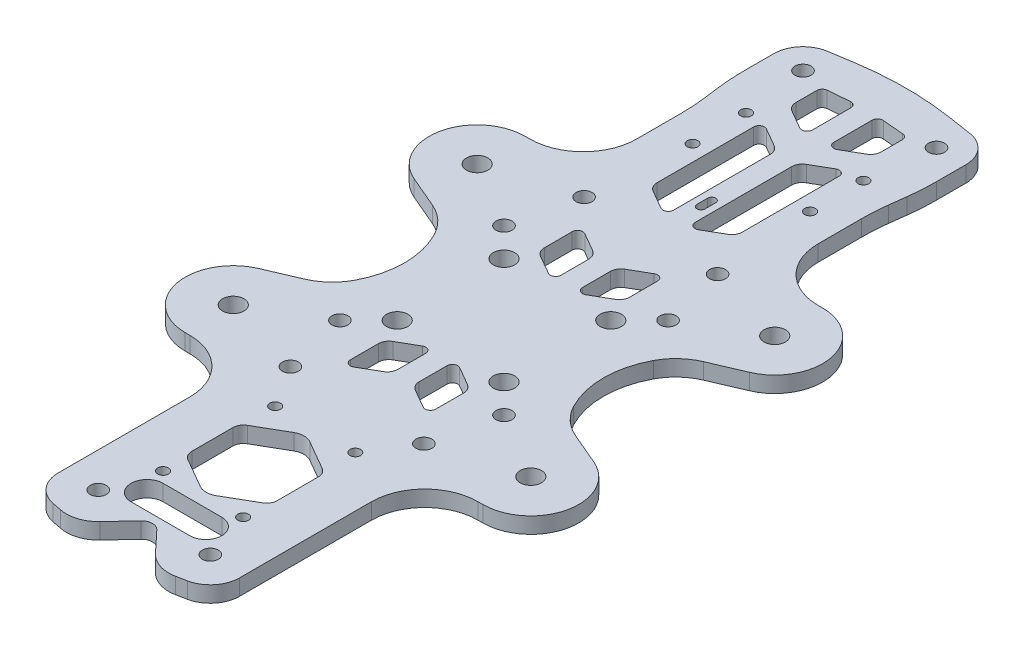
from build123d import *

# Parameters (mm, degrees)
SKETCH2_R           = 1
SKETCH2_R_2         = 1.5
SKETCH2_R_3         = 2
BOSS_EXTRUDE1_DEPTH = 3


with BuildPart() as part:
    # Sketch2 → Boss-Extrude1 (new body)
    with BuildSketch(Plane(origin=(0, 0, 0), x_dir=(1, 0, 0), z_dir=(0, 1, 0))):
        with BuildLine():
            Line((13.350883078, 73.933726478), (8.972891286, 74.619286567))
            ThreePointArc((8.972891286, 74.619286567), (-0.00011783, 75.317584084), (-8.973126945, 74.619286567))
            Line((-8.973126945, 74.619286567), (-13.350882829, 73.933763419))
            ThreePointArc((-13.350882829, 73.933763419), (-16.680339328, 72.07414751), (-17.999976849, 68.496158031))
            Line((-17.999976849, 68.496158031), (-17.99612821, 62.986537073))
            ThreePointArc((-17.99612821, 62.986537073), (-17.913159359, 60.376821385), (-17.66818978, 57.777304179))
            Line((-17.66818978, 57.777304179), (-17.287326461, 54.747455148))
            ThreePointArc((-17.287326461, 54.747455148), (-17.064020516, 52.368886066), (-16.990620696, 49.980985546))
            Line((-16.990620696, 49.980985546), (-16.994414065, 41.83534793))
            ThreePointArc((-16.994414065, 41.83534793), (-19.924991835, 34.767290769), (-26.994412981, 31.840004863))
            Line((-26.994412981, 31.840004863), (-27.864354565, 31.840004863))
            ThreePointArc((-27.864354565, 31.840004863), (-36.681216944, 24.646365231), (-31.403561403, 14.565102148))
            Line((-31.403561403, 14.565102148), (-25.40119143, 11.997866062))
            ThreePointArc((-25.40119143, 11.997866062), (-22.55844214, 10.158571988), (-20.492417257, 7.47607923))
            ThreePointArc((-20.492417257, 7.47607923), (-18.638379202, 0), (-20.492417257, -7.47607923))
            ThreePointArc((-20.492417257, -7.47607923), (-22.55844214, -10.158571988), (-25.40119143, -11.997866062))
            Line((-25.40119143, -11.997866062), (-31.403561403, -14.565102148))
            ThreePointArc((-31.403561403, -14.565102148), (-36.681216944, -24.646365231), (-27.864354565, -31.840004863))
            Line((-27.864354565, -31.840004863), (-26.999999944, -31.840004863))
            ThreePointArc((-26.999999944, -31.840004863), (-19.928932149, -34.768937035), (-16.999999944, -41.840004817))
            Line((-16.999999944, -41.840004817), (-16.999999829, -66.500000018))
            ThreePointArc((-16.999999829, -66.500000018), (-15.752129156, -69.988466165), (-12.574764869, -71.89396701))
            Line((-12.574764869, -71.89396701), (-10.754467086, -72.256667119))
            ThreePointArc((-10.754467086, -72.256667119), (-7.748879832, -72.085454613), (-5.204772908, -70.475986245))
            Line((-5.204772908, -70.475986245), (-1.459074237, -66.480574329))
            ThreePointArc((-1.459074237, -66.480574329), (1.71e-07, -65.848456587), (1.45907458, -66.480574329))
            Line((1.45907458, -66.480574329), (5.204773251, -70.475986245))
            ThreePointArc((5.204773251, -70.475986245), (7.748880174, -72.085454613), (10.754467429, -72.256667119))
            Line((10.754467429, -72.256667119), (12.574765212, -71.89396701))
            ThreePointArc((12.574765212, -71.89396701), (15.752129504, -69.988466158), (17.000000171, -66.5))
            Line((17.000000171, -66.5), (17.000000056, -41.84000491))
            ThreePointArc((17.000000056, -41.84000491), (19.928932228, -34.768937068), (27.000000056, -31.840004863))
            Line((27.000000056, -31.840004863), (27.864354565, -31.840004863))
            ThreePointArc((27.864354565, -31.840004863), (36.681216944, -24.646365231), (31.403561403, -14.565102148))
            Line((31.403561403, -14.565102148), (25.40119143, -11.997866062))
            ThreePointArc((25.40119143, -11.997866062), (22.55844214, -10.158571988), (20.492417257, -7.47607923))
            ThreePointArc((20.492417257, -7.47607923), (18.638379202, 0), (20.492417257, 7.47607923))
            ThreePointArc((20.492417257, 7.47607923), (22.55844214, 10.158571988), (25.40119143, 11.997866062))
            Line((25.40119143, 11.997866062), (31.403561403, 14.565102148))
            ThreePointArc((31.403561403, 14.565102148), (36.681216944, 24.646365231), (27.864354565, 31.840004863))
            Line((27.864354565, 31.840004863), (26.994413119, 31.840004863))
            ThreePointArc((26.994413119, 31.840004863), (19.924991932, 34.767290809), (16.994414203, 41.835348045))
            Line((16.994414203, 41.835348045), (16.990620673, 49.981415095))
            ThreePointArc((16.990620673, 49.981415095), (17.064035313, 52.369081916), (17.28732671, 54.747418207))
            Line((17.28732671, 54.747418207), (17.668190029, 57.777267238))
            ThreePointArc((17.668190029, 57.777267238), (17.913159608, 60.376784444), (17.996128459, 62.986500132))
            Line((17.996128459, 62.986500132), (17.999945801, 68.496188877))
            ThreePointArc((17.999945801, 68.496188877), (16.680306987, 72.074134906), (13.350883078, 73.933726478))
        make_face()
        with Locations(Location((-7.5, -35.348457, 0), (0, 0, 270))):
            Circle(SKETCH2_R, mode=Mode.SUBTRACT)
        with Locations(Location((-7.5, -56.348457, 0), (0, 0, 270))):
            Circle(SKETCH2_R, mode=Mode.SUBTRACT)
        with Locations(Location((7.5, -35.348457, 0), (0, 0, 270))):
            Circle(SKETCH2_R, mode=Mode.SUBTRACT)
        with Locations(Location((7.5, -56.348457, 0), (0, 0, 270))):
            Circle(SKETCH2_R, mode=Mode.SUBTRACT)
        with Locations(Location((-11.000072461, 46.317584084, 0), (0, 0, 270))):
            Circle(SKETCH2_R, mode=Mode.SUBTRACT)
        with Locations(Location((10.999927539, 46.317584084, 0), (0, 0, 270))):
            Circle(SKETCH2_R, mode=Mode.SUBTRACT)
        with Locations(Location((10.999927539, 56.317584084, 0), (0, 0, 90))):
            Circle(SKETCH2_R, mode=Mode.SUBTRACT)
        with Locations(Location((-11.000072461, 56.317584084, 0), (0, 0, 90))):
            Circle(SKETCH2_R, mode=Mode.SUBTRACT)
        with Locations(Location((10.500000167, -65.500000004, 0), (0, 0, 270))):
            Circle(SKETCH2_R_2, mode=Mode.SUBTRACT)
        with Locations(Location((-10.499999829, -65.5, 0), (0, 0, 270))):
            Circle(SKETCH2_R_2, mode=Mode.SUBTRACT)
        with Locations(Location((10.000016395, -10.000011804, 0), (0, 0, 270))):
            Circle(SKETCH2_R_3, mode=Mode.SUBTRACT)
        with Locations(Location((15.365, -15.365, 0), (0, 0, 270))):
            Circle(SKETCH2_R_2, mode=Mode.SUBTRACT)
        with Locations(Location((27.864354565, -22.840004863, 0), (0, 0, 270))):
            Circle(SKETCH2_R_3, mode=Mode.SUBTRACT)
        with Locations(Location((12.500000171, -27.5, 0), (0, 0, 270))):
            Circle(SKETCH2_R_2, mode=Mode.SUBTRACT)
        with Locations(Location((-10.000016395, -10.000011804, 0), (0, 0, 270))):
            Circle(SKETCH2_R_3, mode=Mode.SUBTRACT)
        with Locations(Location((-15.365, -15.365, 0), (0, 0, 270))):
            Circle(SKETCH2_R_2, mode=Mode.SUBTRACT)
        with Locations(Location((-12.499999829, -27.5, 0), (0, 0, 270))):
            Circle(SKETCH2_R_2, mode=Mode.SUBTRACT)
        with Locations(Location((-27.864354565, -22.840004863, 0), (0, 0, 270))):
            Circle(SKETCH2_R_3, mode=Mode.SUBTRACT)
        with Locations(Location((27.864354565, 22.840004863, 0), (0, 0, 270))):
            Circle(SKETCH2_R_3, mode=Mode.SUBTRACT)
        with Locations(Location((15.365, 15.365, 0), (0, 0, 270))):
            Circle(SKETCH2_R_2, mode=Mode.SUBTRACT)
        with Locations(Location((10.000016395, 10.000011804, 0), (0, 0, 270))):
            Circle(SKETCH2_R_3, mode=Mode.SUBTRACT)
        with Locations(Location((-10.000016395, 10.000011804, 0), (0, 0, 270))):
            Circle(SKETCH2_R_3, mode=Mode.SUBTRACT)
        with Locations(Location((-15.365, 15.365, 0), (0, 0, 270))):
            Circle(SKETCH2_R_2, mode=Mode.SUBTRACT)
        with Locations(Location((-27.864354565, 22.840004863, 0), (0, 0, 270))):
            Circle(SKETCH2_R_3, mode=Mode.SUBTRACT)
        with Locations(Location((-12.5, 27.5, 0), (0, 0, 270))):
            Circle(SKETCH2_R_2, mode=Mode.SUBTRACT)
        with Locations(Location((12.5, 27.5, 0), (0, 0, 270))):
            Circle(SKETCH2_R_2, mode=Mode.SUBTRACT)
        with Locations(Location((-12.499997086, 68.499999935, 0), (0, 0, 270))):
            Circle(SKETCH2_R_2, mode=Mode.SUBTRACT)
        with Locations(Location((12.500002914, 68.499999467, 0), (0, 0, 270))):
            Circle(SKETCH2_R_2, mode=Mode.SUBTRACT)
        with BuildLine():
            Line((0.749999899, 38.901923806), (0.749999899, 36.901923806))
            ThreePointArc((0.749999899, 36.901923806), (-1.01e-07, 36.151923806), (-0.750000101, 36.901923806))
            Line((-0.750000101, 36.901923806), (-0.750000101, 38.901923806))
            ThreePointArc((-0.750000101, 38.901923806), (-1.01e-07, 39.651923806), (0.749999899, 38.901923806))
        make_face(mode=Mode.SUBTRACT)
        with BuildLine():
            Line((-5.5, -58.348456587), (5.5, -58.348456587))
            ThreePointArc((5.5, -58.348456587), (8.5, -61.348456587), (5.5, -64.348456587))
            Line((5.5, -64.348456587), (-5.5, -64.348456587))
            ThreePointArc((-5.5, -64.348456587), (-8.5, -61.348456587), (-5.5, -58.348456587))
        make_face(mode=Mode.SUBTRACT)
        with BuildLine():
            Line((7, -41.041451884), (1.5, -37.866025404))
            ThreePointArc((1.5, -37.866025404), (0, -37.464101615), (-1.5, -37.866025404))
            Line((-1.5, -37.866025404), (-7, -41.041451884))
            ThreePointArc((-7, -41.041451884), (-7.732050808, -41.773502692), (-8, -42.773502692))
            Line((-8, -42.773502692), (-8, -50.464101615))
            ThreePointArc((-8, -50.464101615), (-7.732050808, -51.464101615), (-7, -52.196152423))
            Line((-7, -52.196152423), (-1.5, -55.371578903))
            ThreePointArc((-1.5, -55.371578903), (0, -55.773502692), (1.5, -55.371578903))
            Line((1.5, -55.371578903), (7, -52.196152423))
            ThreePointArc((7, -52.196152423), (7.732050808, -51.464101615), (8, -50.464101615))
            Line((8, -50.464101615), (8, -42.773502692))
            ThreePointArc((8, -42.773502692), (7.732050808, -41.773502692), (7, -41.041451884))
        make_face(mode=Mode.SUBTRACT)
        with BuildLine():
            Line((2.999999875, -19.613248636), (6.499999844, -21.633974619))
            ThreePointArc((6.499999844, -21.633974619), (7.500547408, -21.634424586), (8.001989831, -20.768600628))
            Line((8.001989831, -20.768600628), (8.011329949, -15.576420031))
            ThreePointArc((8.011329949, -15.576420031), (7.74515233, -14.5758914), (7.014351026, -13.842517334))
            Line((7.014351026, -13.842517334), (3.517878924, -11.815693189))
            ThreePointArc((3.517878924, -11.815693189), (2.517469418, -11.814186451), (2.016370335, -12.680050851))
            Line((2.016370335, -12.680050851), (2.012220809, -17.900793835))
            ThreePointArc((2.012220809, -17.900793835), (2.276502543, -18.889463725), (2.999999875, -19.613248636))
        make_face(mode=Mode.SUBTRACT)
        with BuildLine():
            Line((-6.500000155, -21.633974611), (-3.00000291, -19.61325026))
            ThreePointArc((-3.00000291, -19.61325026), (-2.26349058, -18.877378982), (-1.992712343, -17.872075))
            Line((-1.992712343, -17.872075), (-1.983656412, -12.672108118))
            ThreePointArc((-1.983656412, -12.672108118), (-2.482135392, -11.805233368), (-3.482110435, -11.803490607))
            Line((-3.482110435, -11.803490607), (-6.985627702, -13.818112198))
            ThreePointArc((-6.985627702, -13.818112198), (-7.718918203, -14.548849716), (-7.988598804, -15.548331908))
            Line((-7.988598804, -15.548331908), (-7.997709151, -20.767528161))
            ThreePointArc((-7.997709151, -20.767528161), (-7.499228332, -21.633538561), (-6.500000155, -21.633974611))
        make_face(mode=Mode.SUBTRACT)
        with BuildLine():
            Line((3.517878923, 11.815693192), (7.014351026, 13.842517334))
            ThreePointArc((7.014351026, 13.842517334), (7.74515233, 14.5758914), (8.011329949, 15.576420031))
            Line((8.011329949, 15.576420031), (8.001989831, 20.768600628))
            ThreePointArc((8.001989831, 20.768600628), (7.500547408, 21.634424586), (6.499999844, 21.633974619))
            Line((6.499999844, 21.633974619), (2.999999852, 19.613248675))
            ThreePointArc((2.999999852, 19.613248675), (2.276502504, 18.889463747), (2.012220763, 17.900793835))
            Line((2.012220763, 17.900793835), (2.016370338, 12.680050851))
            ThreePointArc((2.016370338, 12.680050851), (2.517469419, 11.814186454), (3.517878923, 11.815693192))
        make_face(mode=Mode.SUBTRACT)
        with BuildLine():
            Line((-3.00000291, 19.61325026), (-6.500000155, 21.633974611))
            ThreePointArc((-6.500000155, 21.633974611), (-7.499228332, 21.633538561), (-7.997709151, 20.767528161))
            Line((-7.997709151, 20.767528161), (-7.988598804, 15.548331908))
            ThreePointArc((-7.988598804, 15.548331908), (-7.718918202, 14.548849716), (-6.985627702, 13.818112198))
            Line((-6.985627702, 13.818112198), (-3.482110435, 11.803490607))
            ThreePointArc((-3.482110435, 11.803490607), (-2.482135392, 11.805233368), (-1.983656412, 12.672108118))
            Line((-1.983656412, 12.672108118), (-1.992712343, 17.872075))
            ThreePointArc((-1.992712343, 17.872075), (-2.26349058, 18.877378982), (-3.00000291, 19.61325026))
        make_face(mode=Mode.SUBTRACT)
        with BuildLine():
            Line((3.499999899, 32.901923807), (6.999999893, 34.922649745))
            ThreePointArc((6.999999893, 34.922649745), (7.732050697, 35.654700549), (7.999999886, 36.654700545))
            Line((7.999999886, 36.654700545), (7.999999845, 54.767949218))
            ThreePointArc((7.999999845, 54.767949218), (7.499999844, 55.63397462), (6.499999845, 55.633974619))
            Line((6.499999845, 55.633974619), (2.999999852, 53.61324868))
            ThreePointArc((2.999999852, 53.61324868), (2.267949047, 52.881197873), (1.999999857, 51.881197876))
            Line((1.999999857, 51.881197876), (1.999999896, 33.767949211))
            ThreePointArc((1.999999896, 33.767949211), (2.499999898, 32.901923807), (3.499999899, 32.901923807))
        make_face(mode=Mode.SUBTRACT)
        with BuildLine():
            Line((-7.000000107, 34.922649752), (-3.500000101, 32.901923805))
            ThreePointArc((-3.500000101, 32.901923805), (-2.500023539, 32.901923382), (-2.00003416, 33.767927854))
            Line((-2.00003416, 33.767927854), (-2.000000143, 51.881191279))
            ThreePointArc((-2.000000143, 51.881191279), (-2.267949232, 52.881195963), (-3.00000291, 53.61325026))
            Line((-3.00000291, 53.61325026), (-6.500000155, 55.63397461))
            ThreePointArc((-6.500000155, 55.63397461), (-7.500001159, 55.633974031), (-8.000000155, 54.767946888))
            Line((-8.000000155, 54.767946888), (-7.999953523, 36.654615238))
            ThreePointArc((-7.999953523, 36.654615238), (-7.732015654, 35.654664451), (-7.000000107, 34.922649752))
        make_face(mode=Mode.SUBTRACT)
        with BuildLine():
            Line((3.499999898, 58.901923808), (6.999999892, 60.922649745))
            ThreePointArc((6.999999892, 60.922649745), (7.732050701, 61.654700553), (7.999999893, 62.654700553))
            Line((7.999999893, 62.654700553), (7.999999882, 66.594635247))
            ThreePointArc((7.999999882, 66.594635247), (7.737277218, 67.270225453), (7.087155625, 67.590829944))
            Line((7.087155625, 67.590829944), (3.087155624, 67.940784602))
            ThreePointArc((3.087155624, 67.940784602), (2.324409672, 67.68186724), (1.99999988, 66.944589901))
            Line((1.99999988, 66.944589901), (1.999999898, 59.76794921))
            ThreePointArc((1.999999898, 59.76794921), (2.499999899, 58.901923808), (3.499999898, 58.901923808))
        make_face(mode=Mode.SUBTRACT)
        with BuildLine():
            Line((-7.000000108, 60.922649753), (-3.500000102, 58.901923807))
            ThreePointArc((-3.500000102, 58.901923807), (-2.500000101, 58.901923807), (-2.000000102, 59.767949212))
            Line((-2.000000102, 59.767949212), (-2.000000119, 66.9445899))
            ThreePointArc((-2.000000119, 66.9445899), (-2.324409912, 67.681867235), (-3.087155862, 67.940784596))
            Line((-3.087155862, 67.940784596), (-7.087155862, 67.590829942))
            ThreePointArc((-7.087155862, 67.590829942), (-7.737277457, 67.27022545), (-8.00000012, 66.594635241))
            Line((-8.00000012, 66.594635241), (-8.000000107, 62.654700557))
            ThreePointArc((-8.000000107, 62.654700557), (-7.732050914, 61.654700559), (-7.000000108, 60.922649753))
        make_face(mode=Mode.SUBTRACT)
    extrude(amount=BOSS_EXTRUDE1_DEPTH)


solid = part.part
